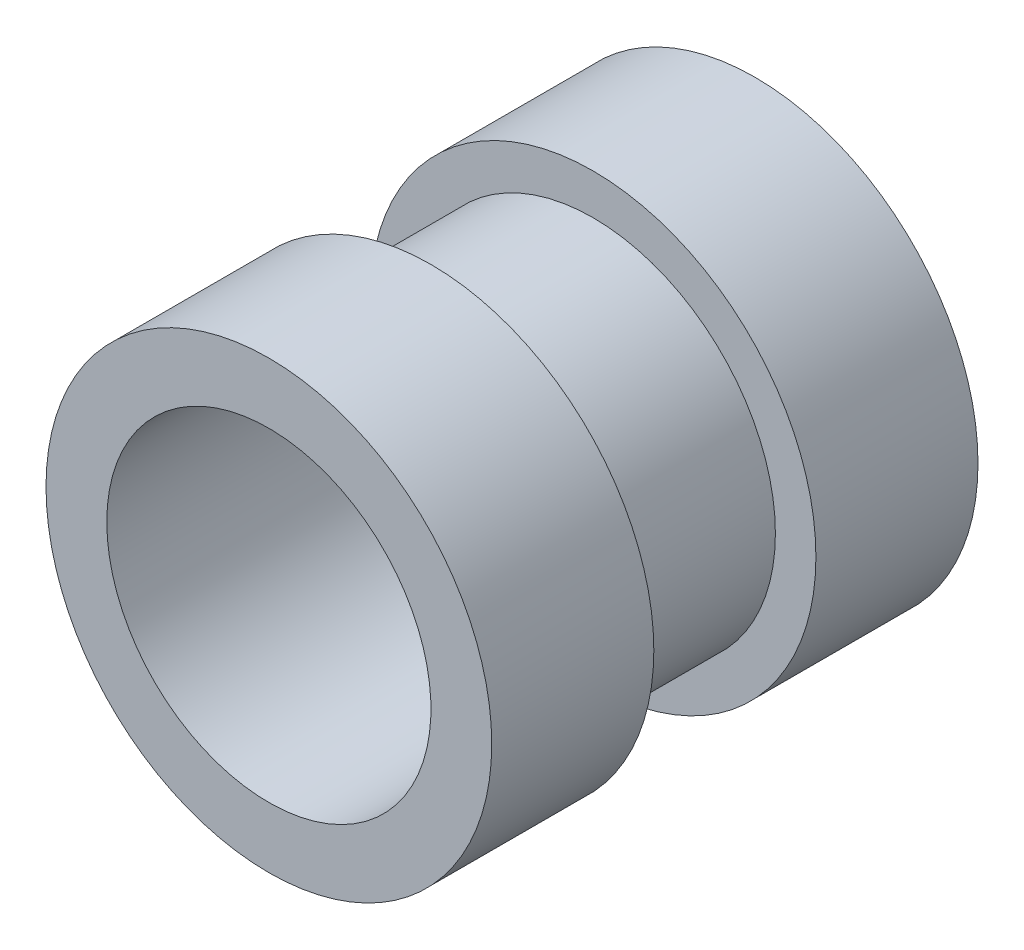
from build123d import *

# Parameters (mm, degrees)
SKETCH2_R          = 2
CUT_EXTRUDE1_DEPTH = 8.150174823


with BuildPart() as part:
    # Sketch1 → Revolve1 (revolve)
    with BuildSketch(Plane(origin=(0, 0, 0), x_dir=(1, 0, 0), z_dir=(0, 1, 0)), mode=Mode.PRIVATE) as revolve1_sk:
        Polygon((0, 0), (2.75, 0), (2.75, 2), (2.25, 2), (2.25, 4), (2.75, 4), (2.75, 6), (0, 6), align=None)
    revolve(revolve1_sk.sketch.rotate(Axis((0, 0, -11.944023292), (0, 0, 1)), 180), axis=Axis((0, 0, -11.944023292), (0, 0, 1)))

    # Sketch2 → Cut-Extrude1 (cut, through all)
    with BuildSketch(Plane(origin=(0, 0, -6), x_dir=(-1, 0, 0), z_dir=(0, 0, -1))):
        Circle(SKETCH2_R)
    extrude(amount=-CUT_EXTRUDE1_DEPTH, mode=Mode.SUBTRACT)


solid = part.part
